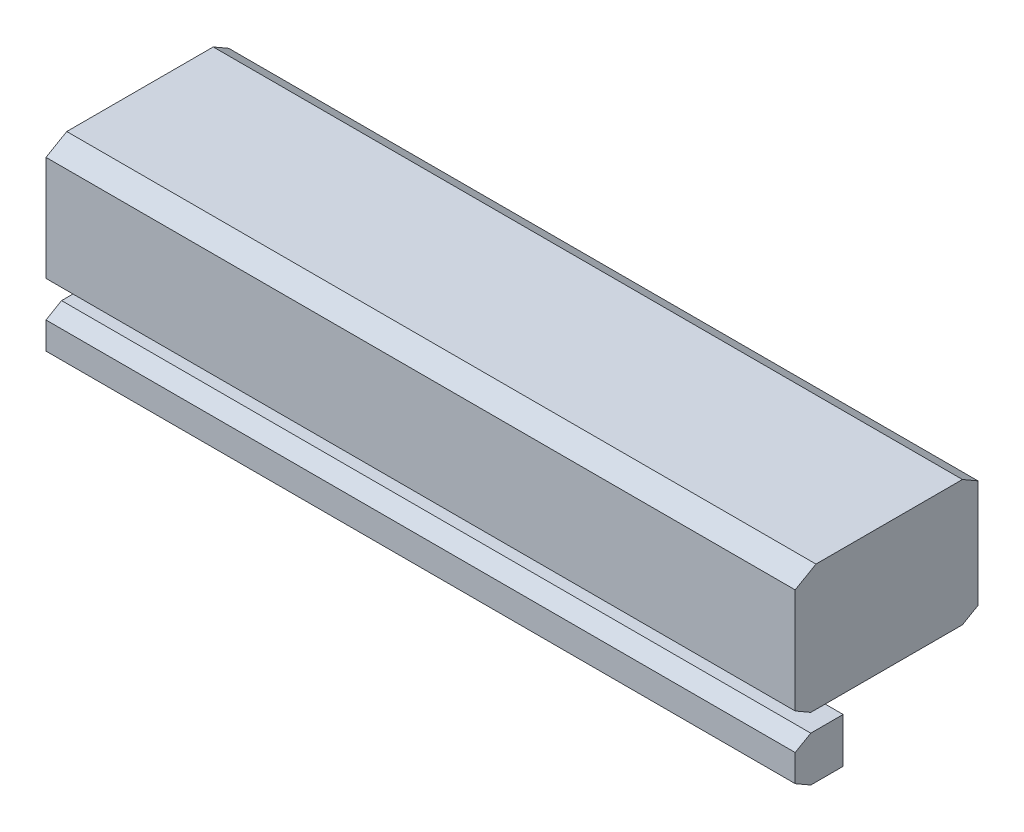
from build123d import *
from OCP.BRepFilletAPI import BRepFilletAPI_MakeChamfer

# Parameters (mm, degrees)
SKETCH_1_W                   = 61
SKETCH_1_H                   = 42
EXTRUDE_1_DEPTH              = 125
CHAMFER_1_SIZE               = 4
CHAMFER_1_SIZE2              = 6.92820323
CHAMFER_2_SIZE               = 3
CHAMFER_2_SIZE2              = 5.196152423
EXTRUDE_2_DEPTH              = 55
SKETCH_4_W                   = 16
SKETCH_4_H                   = 15
EXTRUDE_3_DEPTH              = 125
CHAMFER_3_SIZE               = 3
CHAMFER_3_SIZE2              = 5.196152423
CUT_EXTRUDE_1_REACH          = 154.571
SKETCH_5_W                   = 70
SKETCH_5_H                   = 33
HOLE_WIZARD_M5_1_D           = 4.2
HOLE_WIZARD_M5_1_DEPTH       = 6
HOLE_WIZARD_M5_1_CSINK_D     = 5.05
HOLE_WIZARD_M5_1_CSINK_ANGLE = 90


with BuildPart() as part:
    # 草图1 → 凸台-拉伸1 (new, symmetric)
    with BuildSketch(Plane(origin=(0, 0, 0), x_dir=(0, 0, -1), z_dir=(1, 0, 0))):
        Rectangle(SKETCH_1_W, SKETCH_1_H)
    extrude(amount=EXTRUDE_1_DEPTH, both=True)

    # 倒角1
    chamfer_1_edges = [part.edges().sort_by_distance(p)[0] for p in [
        (0, 21, 30.5),
    ]]
    chamfer_1_side = [part.faces().sort_by_distance(p)[0] for p in [
        (0, 0, 30.5),
    ]]
    chamfer(chamfer_1_edges, length=CHAMFER_1_SIZE, length2=CHAMFER_1_SIZE2, reference=chamfer_1_side[0])

    # 倒角2: one chamfer whose edges measure the first distance from different faces: ONE call of the kernel's chamfer builder (chamfer() names one face for all edges)
    chamfer_2_edges_1 = [part.edges().sort_by_distance(p)[0] for p in [
        (0, 21, -30.5),
        (0, -21, -30.5),
    ]]
    chamfer_2_side_1 = [part.faces().sort_by_distance(p)[0] for p in [
        (0, 0, -30.5),
    ]]
    chamfer_2_edges_2 = [part.edges().sort_by_distance(p)[0] for p in [
        (0, -21, 30.5),
    ]]
    chamfer_2_side_2 = [part.faces().sort_by_distance(p)[0] for p in [
        (0, -2, 30.5),
    ]]
    chamfer_2 = BRepFilletAPI_MakeChamfer(part.part.solid().wrapped)
    for e in chamfer_2_edges_1:
        chamfer_2.Add(CHAMFER_2_SIZE, CHAMFER_2_SIZE2, e.wrapped, chamfer_2_side_1[0].wrapped)  # the first distance lies on this face
    for e in chamfer_2_edges_2:
        chamfer_2.Add(CHAMFER_2_SIZE, CHAMFER_2_SIZE2, e.wrapped, chamfer_2_side_2[0].wrapped)  # the first distance lies on this face
    add(Compound.cast(chamfer_2.Shape()), mode=Mode.REPLACE)

    # 草图3 → 凸台-拉伸2 (add, symmetric)
    with BuildSketch(Plane(origin=(0, 0, 0), x_dir=(0, 0, -1), z_dir=(1, 0, 0))):
        Polygon((-20.303847577, -21), (-14.303847577, -21), (-14.303847577, -36), (60.696152423, -36), (60.696152423, -42), (-14.303847577, -42), (-20.303847577, -42), align=None)
    extrude(amount=EXTRUDE_2_DEPTH, both=True)

    # 草图4 → 凸台-拉伸3 (add, symmetric)
    with BuildSketch(Plane(origin=(0, 0, 0), x_dir=(0, 0, -1), z_dir=(1, 0, 0))):
        with Locations((-22.5, -34.5)):
            Rectangle(SKETCH_4_W, SKETCH_4_H)
    extrude(amount=EXTRUDE_3_DEPTH, both=True)

    # 倒角3
    chamfer_3_edges = [part.edges().sort_by_distance(p)[0] for p in [
        (0, -27, 30.5),
        (0, -42, 30.5),
    ]]
    chamfer_3_side = [part.faces().sort_by_distance(p)[0] for p in [
        (0, -34.5, 30.5),
    ]]
    chamfer(chamfer_3_edges, length=CHAMFER_3_SIZE, length2=CHAMFER_3_SIZE2, reference=chamfer_3_side[0])

    # 草图5 → 切除-拉伸1 (cut, up to next)
    with BuildSketch(Plane.XZ.offset(42), mode=Mode.PRIVATE) as cut_extrude_1_sk1:
        with Locations((0, -34.196152423)):
            Rectangle(SKETCH_5_W, SKETCH_5_H)
    cut_extrude_1_tool1 = extrude(cut_extrude_1_sk1.sketch, amount=-CUT_EXTRUDE_1_REACH, mode=Mode.PRIVATE) & part.part
    add(cut_extrude_1_tool1.solids().sort_by_distance((0, -42, -34.196152))[0], mode=Mode.SUBTRACT)

    # M5 螺纹孔1
    with Locations(Plane.XZ.offset(42)):
        with Locations((0, -1.5)):
            CounterSinkHole(HOLE_WIZARD_M5_1_D / 2, HOLE_WIZARD_M5_1_CSINK_D / 2, depth=HOLE_WIZARD_M5_1_DEPTH, counter_sink_angle=HOLE_WIZARD_M5_1_CSINK_ANGLE)


solid = part.part
